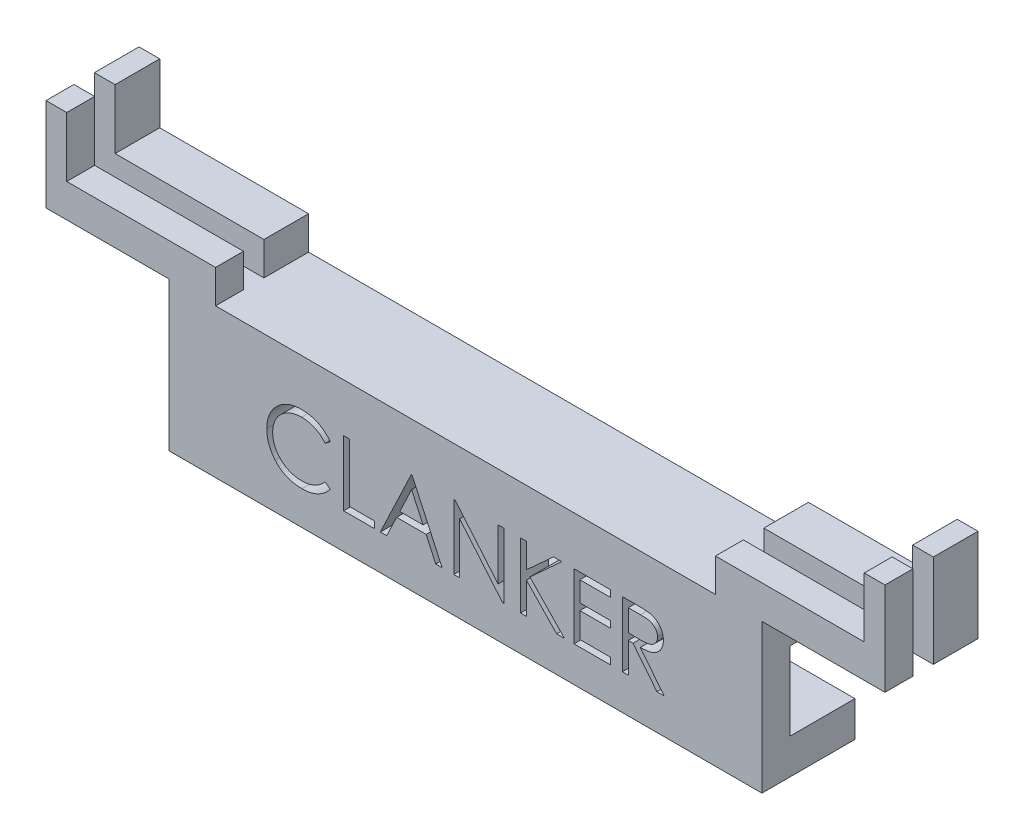
from build123d import *

# Parameters (mm, degrees)
BOSS_EXTRUDE1_DEPTH   = 5
BOSS_EXTRUDE1_2_DEPTH = 5
SKETCH4_W             = 31.87087044
SKETCH4_H             = 8
BOSS_EXTRUDE2_DEPTH   = 5
SKETCH5_W             = 32.67615924
SKETCH5_H             = 4.2
CUT_EXTRUDE1_DEPTH    = 3.5
SKETCH6_W             = 45.1
SKETCH6_H             = 1.1
CUT_EXTRUDE2_DEPTH    = 5
CUT_EXTRUDE3_DEPTH    = 3


with BuildPart() as part:
    # Sketch2 → Boss-Extrude1 (new body)
    with BuildSketch(Plane.XY):
        Polygon((21.435301444, 2.5), (21.435301444, -0.71006712), (13.43543522, -0.71006712), (13.43543522, -2.5), (22.55, -2.5), (22.55, 2.5), align=None)
    extrude(amount=-BOSS_EXTRUDE1_DEPTH)



with BuildPart() as body_2:
    # Sketch2 → Boss-Extrude1 2 (new body)
    with BuildSketch(Plane.XY):
        Polygon((-22.55, 2.5), (-21.435301444, 2.5), (-21.435301444, -0.71006712), (-13.43543522, -0.71006712), (-13.43543522, -2.5), (-22.55, -2.5), align=None)
    extrude(amount=-BOSS_EXTRUDE1_2_DEPTH)


with BuildPart() as part_1:
    add(part.part)

    add(body_2.part)  # Boss-Extrude2 merges body 2
    # Sketch4 → Boss-Extrude2 (add)
    with BuildSketch(Plane.XY):
        with Locations((0, -6.5)):
            Rectangle(SKETCH4_W, SKETCH4_H)
    extrude(amount=-BOSS_EXTRUDE2_DEPTH)

    # Sketch5 → Cut-Extrude1 (cut)
    with BuildSketch(Plane(origin=(0, 0, -5), x_dir=(-1, 0, 0), z_dir=(0, 0, -1))):
        with Locations((0, -6.5)):
            Rectangle(SKETCH5_W, SKETCH5_H)
    extrude(amount=-CUT_EXTRUDE1_DEPTH, mode=Mode.SUBTRACT)

    # Sketch6 → Cut-Extrude2 (cut)
    with BuildSketch(Plane(origin=(0, 2.5, 0), x_dir=(1, 0, 0), z_dir=(0, 1, 0))):
        with Locations((0, 2.05)):
            Rectangle(SKETCH6_W, SKETCH6_H)
    extrude(amount=-CUT_EXTRUDE2_DEPTH, mode=Mode.SUBTRACT)

    # Sketch7 → Cut-Extrude3 (cut)
    # profile 1 of 7: a face of its own
    with BuildSketch(Plane.XY):
        with BuildLine():
            Line((-7.269230769, -5.742227564), (-7.544070513, -5.952564103))
            add(Edge.make_bspline(
                [(-7.544070513, -5.952564103), (-7.563676401, -5.929198133), (-7.602623848, -5.882781217), (-7.665283051, -5.817601673), (-7.730584693, -5.756536411), (-7.798503815, -5.699294531), (-7.870262934, -5.647877766), (-7.944123733, -5.599606663), (-8.021321778, -5.556338925), (-8.128073513, -5.503875939), (-8.267721361, -5.449129784), (-8.4435162, -5.403226552), (-8.627027298, -5.374005377), (-8.752224898, -5.370840535), (-8.815905449, -5.369230769)],
                knots=[0, 0, 0, 0, 0.757959112, 1.505699292, 2.245454638, 2.979532153, 3.711538275, 4.438200793, 5.171680507, 5.909471876, 7.393775596, 8.890124382, 10.418191784, 12, 12, 12, 12], degree=3))
            add(Edge.make_bspline(
                [(-8.815905449, -5.369230769), (-8.850988748, -5.369634732), (-8.920829741, -5.370438908), (-9.024478214, -5.381048033), (-9.126191265, -5.395959243), (-9.225902731, -5.418084566), (-9.32348569, -5.446057185), (-9.419578092, -5.479482599), (-9.512788692, -5.520837439), (-9.60440693, -5.566545699), (-9.692186141, -5.618173144), (-9.775241189, -5.674486496), (-9.853269157, -5.734855592), (-9.926331769, -5.799506698), (-9.994503717, -5.868148659), (-10.057291028, -5.941513), (-10.114476438, -6.019365174), (-10.167193463, -6.100678581), (-10.214406197, -6.185216373), (-10.253936076, -6.273291444), (-10.288941198, -6.363395547), (-10.316640441, -6.456546707), (-10.338564958, -6.552089473), (-10.353692621, -6.650280261), (-10.364181092, -6.750913941), (-10.364981269, -6.819123253), (-10.365384615, -6.853505609)],
                knots=[0, 0, 0, 0, 1.054917814, 2.100044995, 3.131103042, 4.146048494, 5.169673617, 6.183595914, 7.203665975, 8.234915748, 9.262203917, 10.264457458, 11.251630812, 12.227803204, 13.197192746, 14.159520551, 15.12972552, 16.100847026, 17.073214652, 18.039054194, 19.002613845, 19.979014051, 20.95965708, 21.949030935, 22.966165397, 24, 24, 24, 24], degree=3))
            add(Edge.make_bspline(
                [(-10.365384615, -6.853505609), (-10.364122796, -6.905236929), (-10.361645382, -7.006804514), (-10.339597048, -7.155575124), (-10.306091957, -7.298095798), (-10.25587638, -7.43347564), (-10.193957329, -7.563383998), (-10.115716718, -7.685622852), (-10.02510018, -7.802039416), (-9.920825761, -7.909882364), (-9.806419945, -8.008396089), (-9.683672033, -8.095146671), (-9.552887746, -8.167461553), (-9.415511115, -8.2276375), (-9.270485001, -8.273894228), (-9.118070199, -8.306458351), (-8.958598204, -8.327700532), (-8.849628804, -8.32973422), (-8.794170673, -8.330769231)],
                knots=[0, 0, 0, 0, 1.029171465, 2.020641659, 2.987623507, 3.938342917, 4.889210282, 5.84687017, 6.821220943, 7.821438502, 8.827599549, 9.822697543, 10.807740252, 11.797342354, 12.80366471, 13.83203677, 14.896651826, 16, 16, 16, 16], degree=3))
            add(Edge.make_bspline(
                [(-8.794170673, -8.330769231), (-8.733067984, -8.329080451), (-8.612803275, -8.325756528), (-8.436435249, -8.297597279), (-8.267599483, -8.251939362), (-8.106286897, -8.188041439), (-7.95295225, -8.104976151), (-7.80735559, -8.004278274), (-7.66937402, -7.884989941), (-7.586402737, -7.793906813), (-7.544070513, -7.747435897)],
                knots=[0, 0, 0, 0, 1.028121516, 2.023589091, 2.998037872, 3.967518031, 4.937445131, 5.927275754, 6.942489185, 8, 8, 8, 8], degree=3))
            Line((-7.544070513, -7.747435897), (-7.269230769, -7.955669071))
            add(Edge.make_bspline(
                [(-7.269230769, -7.955669071), (-7.291348879, -7.984207522), (-7.335479154, -8.041147729), (-7.406937171, -8.121419438), (-7.482214469, -8.196923474), (-7.561870179, -8.267051095), (-7.64498797, -8.333205561), (-7.733060283, -8.393507392), (-7.824929315, -8.448798276), (-7.920283794, -8.499425201), (-8.019022407, -8.544342448), (-8.121026842, -8.582796216), (-8.225857417, -8.615921105), (-8.333518926, -8.643173042), (-8.444234683, -8.664444126), (-8.557605157, -8.678663801), (-8.673875032, -8.688405715), (-8.752316453, -8.689293631), (-8.792067308, -8.68974359)],
                knots=[0, 0, 0, 0, 0.986787822, 1.968848986, 2.935600012, 3.899624008, 4.868462664, 5.837806735, 6.815139263, 7.798259679, 8.787526145, 9.778297419, 10.776456485, 11.791383307, 12.812564526, 13.85620153, 14.913611965, 16, 16, 16, 16], degree=3))
            add(Edge.make_bspline(
                [(-8.792067308, -8.68974359), (-8.829710975, -8.689481597), (-8.904146665, -8.688963539), (-9.014045416, -8.680571372), (-9.121034997, -8.669121635), (-9.224809623, -8.651881504), (-9.325935598, -8.631537164), (-9.423496183, -8.604265907), (-9.518451393, -8.573716741), (-9.610419734, -8.537811754), (-9.699479434, -8.497295571), (-9.785343245, -8.451504013), (-9.867971677, -8.400822148), (-9.948177098, -8.346367137), (-10.024774682, -8.286389836), (-10.098428207, -8.221723201), (-10.169550683, -8.15258519), (-10.213553368, -8.102730337), (-10.235677083, -8.077664263)],
                knots=[0, 0, 0, 0, 1.114604814, 2.203992996, 3.262667896, 4.300477797, 5.318619304, 6.316056647, 7.298880507, 8.271930387, 9.238335007, 10.195173496, 11.151986948, 12.108099108, 13.064862484, 14.031167946, 15.010108607, 16, 16, 16, 16], degree=3))
            add(Edge.make_bspline(
                [(-10.235677083, -8.077664263), (-10.271112727, -8.034123074), (-10.341556204, -7.947566363), (-10.431681887, -7.807280382), (-10.508829442, -7.660812173), (-10.571205363, -7.507392245), (-10.619968096, -7.347364857), (-10.653749291, -7.180649343), (-10.675700896, -7.007401401), (-10.678211185, -6.889564612), (-10.679487179, -6.829667468)],
                knots=[0, 0, 0, 0, 0.994628077, 1.977248131, 2.950237994, 3.925870899, 4.908910175, 5.911660606, 6.938484602, 8, 8, 8, 8], degree=3))
            add(Edge.make_bspline(
                [(-10.679487179, -6.829667468), (-10.677931986, -6.766712014), (-10.67487224, -6.64285109), (-10.648876444, -6.461077137), (-10.607057648, -6.286925738), (-10.547660759, -6.120721993), (-10.472355408, -5.961591713), (-10.379328794, -5.810750508), (-10.269661652, -5.667233708), (-10.144214084, -5.533218957), (-10.006646749, -5.410679604), (-9.859327935, -5.302873401), (-9.702545988, -5.213155885), (-9.538028137, -5.138159722), (-9.364542455, -5.080515259), (-9.182459086, -5.040162072), (-8.992120171, -5.015044956), (-8.862257745, -5.011869748), (-8.796274038, -5.01025641)],
                knots=[0, 0, 0, 0, 1.032925535, 2.032216505, 3.007276963, 3.968222605, 4.92396291, 5.891752235, 6.871517503, 7.883894988, 8.900124299, 9.891468569, 10.874487609, 11.85992873, 12.854644235, 13.869047385, 14.917252991, 16, 16, 16, 16], degree=3))
            add(Edge.make_bspline(
                [(-8.796274038, -5.01025641), (-8.756059567, -5.010738548), (-8.676459069, -5.011692892), (-8.558706417, -5.020999035), (-8.44406409, -5.036512641), (-8.332453108, -5.057628711), (-8.223330492, -5.083836032), (-8.117530251, -5.11797633), (-8.014431564, -5.157012862), (-7.914684656, -5.201971328), (-7.818768106, -5.252438069), (-7.726711787, -5.307853693), (-7.639246928, -5.368149498), (-7.55575808, -5.432812674), (-7.477641869, -5.503211233), (-7.40268039, -5.577408829), (-7.333419312, -5.657542653), (-7.290666117, -5.713947587), (-7.269230769, -5.742227564)],
                knots=[0, 0, 0, 0, 1.096760587, 2.17092713, 3.219439832, 4.250915756, 5.268269357, 6.278326846, 7.281116186, 8.274029601, 9.260640565, 10.235837813, 11.203064059, 12.156899882, 13.114053108, 14.069676657, 15.032185724, 16, 16, 16, 16], degree=3))
        make_face()
    # profile 2 of 7: a face of its own
    with BuildSketch(Plane.XY):
        Polygon((-6.551282051, -5.1), (-6.237179487, -5.1), (-6.237179487, -8.241025641), (-4.891025641, -8.241025641), (-4.891025641, -8.6), (-6.551282051, -8.6), align=None)
    # profile 3 of 7: a face of its own
    with BuildSketch(Plane.XY):
        Polygon((-2.871794872, -5.1), (-1.256410256, -8.6), (-1.597856571, -8.6), (-2.115284455, -7.478205128), (-3.701923077, -7.478205128), (-4.234074519, -8.6), (-4.576923077, -8.6), (-2.916666667, -5.1), align=None)
        Polygon((-2.897736378, -5.782191506), (-3.531550481, -7.119230769), (-2.280749199, -7.119230769), align=None, mode=Mode.SUBTRACT)
    # profile 4 of 7: a face of its own
    with BuildSketch(Plane.XY):
        Polygon((-0.628205128, -8.6), (-0.628205128, -5.1), (-0.562299679, -5.1), (1.75, -7.854707532), (1.75, -5.1), (2.064102564, -5.1), (2.064102564, -8.6), (1.992588141, -8.6), (-0.314102564, -5.851602564), (-0.314102564, -8.6), align=None)
    # profile 5 of 7: a face of its own
    with BuildSketch(Plane.XY):
        Polygon((2.961538462, -5.1), (3.275641026, -5.1), (3.275641026, -6.432832532), (4.734675481, -5.1), (5.182692308, -5.1), (3.462840545, -6.670512821), (5.317307692, -8.6), (4.898737981, -8.6), (3.275641026, -6.910997596), (3.275641026, -8.6), (2.961538462, -8.6), align=None)
    # profile 6 of 7: a face of its own
    with BuildSketch(Plane.XY):
        Polygon((5.833333333, -5.1), (7.807692308, -5.1), (7.807692308, -5.458974359), (6.147435897, -5.458974359), (6.147435897, -6.535897436), (7.807692308, -6.535897436), (7.807692308, -6.894871795), (6.147435897, -6.894871795), (6.147435897, -8.241025641), (7.807692308, -8.241025641), (7.807692308, -8.6), (5.833333333, -8.6), align=None)
    # profile 7 of 7: a face of its own
    with BuildSketch(Plane.XY):
        with BuildLine():
            Line((8.435897436, -5.1), (9.136318109, -5.1))
            add(Edge.make_bspline(
                [(9.136318109, -5.1), (9.183059237, -5.100155586), (9.272807382, -5.100454328), (9.401380652, -5.102120091), (9.518207749, -5.106894447), (9.623227589, -5.11100303), (9.716438244, -5.118494972), (9.798125534, -5.125655619), (9.867913232, -5.13502928), (9.910159083, -5.143734703), (9.929286859, -5.147676282)],
                knots=[0, 0, 0, 0, 1.410062039, 2.707475311, 3.878576406, 4.937260626, 5.877586885, 6.699081471, 7.410979367, 8, 8, 8, 8], degree=3))
            add(Edge.make_bspline(
                [(9.929286859, -5.147676282), (9.954893483, -5.154003047), (10.005560473, -5.166521611), (10.078510539, -5.192981212), (10.148024863, -5.223600837), (10.213814687, -5.259564557), (10.275550478, -5.301139337), (10.333868789, -5.347607459), (10.389034252, -5.398714665), (10.438815882, -5.455749506), (10.485754934, -5.515586016), (10.525343561, -5.580289773), (10.55947004, -5.6479513), (10.586640557, -5.719258718), (10.608518531, -5.79352049), (10.62394477, -5.871409287), (10.633195958, -5.952570262), (10.634137813, -6.00792817), (10.634615385, -6.035997596)],
                knots=[0, 0, 0, 0, 1.027469482, 2.033020251, 3.019912614, 3.986113645, 4.951240523, 5.91722682, 6.890402269, 7.87763091, 8.8651537, 9.85103654, 10.82876324, 11.815024772, 12.821070561, 13.842952187, 14.906261191, 16, 16, 16, 16], degree=3))
            add(Edge.make_bspline(
                [(10.634615385, -6.035997596), (10.633146387, -6.082632701), (10.630279991, -6.173629869), (10.603554887, -6.30569075), (10.559778367, -6.428880065), (10.499455078, -6.543042703), (10.422635603, -6.645953348), (10.330310811, -6.736343803), (10.2224292, -6.811983716), (10.121999884, -6.864436521), (10.033285684, -6.898029429), (9.960252372, -6.921665788), (9.880585394, -6.939927753), (9.795048059, -6.956287885), (9.703284404, -6.96863958), (9.605514365, -6.977686174), (9.501668213, -6.983340223), (9.430329144, -6.984182228), (9.393629808, -6.984615385)],
                knots=[0, 0, 0, 0, 1.260483769, 2.459530307, 3.627416485, 4.787058657, 5.939039949, 7.08810263, 8.267026773, 9.491475466, 10.141966685, 10.831826277, 11.566392101, 12.351337768, 13.187381173, 14.07005841, 15.007169909, 16, 16, 16, 16], degree=3))
            Line((9.393629808, -6.984615385), (10.679487179, -8.6))
            Line((10.679487179, -8.6), (10.291065705, -8.6))
            Line((10.291065705, -8.6), (9.005208333, -6.984615385))
            Line((9.005208333, -6.984615385), (8.75, -6.984615385))
            Line((8.75, -6.984615385), (8.75, -8.6))
            Line((8.75, -8.6), (8.435897436, -8.6))
            Line((8.435897436, -8.6), (8.435897436, -5.1))
        make_face()
        with BuildLine():
            Line((8.75, -5.458974359), (8.75, -6.625641026))
            Line((8.75, -6.625641026), (9.390825321, -6.630548878))
            add(Edge.make_bspline(
                [(9.390825321, -6.630548878), (9.420745359, -6.630562115), (9.478738917, -6.630587771), (9.562639581, -6.626593995), (9.640759693, -6.622050677), (9.712800445, -6.615101331), (9.778794021, -6.60614526), (9.838707434, -6.594942275), (9.892638486, -6.581890213), (9.955537024, -6.561688587), (10.025773555, -6.529682569), (10.102105015, -6.48311707), (10.167107353, -6.424547951), (10.222025215, -6.357574495), (10.266154647, -6.283938246), (10.297266701, -6.204521877), (10.317009143, -6.121330279), (10.319337689, -6.064152171), (10.320512821, -6.035296474)],
                knots=[0, 0, 0, 0, 1.146690395, 2.22261258, 3.21895312, 4.145990853, 4.996080663, 5.770904154, 6.481378293, 7.121626537, 8.300444488, 9.431385265, 10.535395872, 11.636531494, 12.74115979, 13.810798291, 14.895190096, 16, 16, 16, 16], degree=3))
            add(Edge.make_bspline(
                [(10.320512821, -6.035296474), (10.319310699, -6.007149901), (10.316928534, -5.951373662), (10.297479766, -5.869717752), (10.264590384, -5.792650802), (10.220268146, -5.720486317), (10.166268991, -5.654980581), (10.102951179, -5.598933428), (10.032045983, -5.552683963), (9.965774785, -5.523129582), (9.906540573, -5.505009729), (9.855110913, -5.492258565), (9.796999435, -5.482014096), (9.731923976, -5.473806036), (9.660162345, -5.466751091), (9.581351694, -5.461999313), (9.496014914, -5.459185449), (9.436867983, -5.45904636), (9.40625, -5.458974359)],
                knots=[0, 0, 0, 0, 1.101028733, 2.181837193, 3.264309656, 4.369019818, 5.486613113, 6.575447106, 7.666700264, 8.788928104, 9.402425223, 10.0903467, 10.862060571, 11.710948788, 12.657782767, 13.684531032, 14.801375019, 16, 16, 16, 16], degree=3))
            Line((9.40625, -5.458974359), (8.75, -5.458974359))
        make_face(mode=Mode.SUBTRACT)
    extrude(amount=-CUT_EXTRUDE3_DEPTH, mode=Mode.SUBTRACT)


with BuildPart() as cut_extrude3_piece_1:
    # of the separate pieces the step leaves, piece 1, a body of its own (cut_extrude3_pieces)
    add(part_1.part.solids().sort_by_distance((21.435301444, 2.5, 0))[0])


with BuildPart() as cut_extrude3_piece_2:
    # of the separate pieces the step leaves, piece 2, a body of its own (cut_extrude3_pieces)
    add(part_1.part.solids().sort_by_distance((9.40625, -5.458974359, 0))[0])


with BuildPart() as cut_extrude3_piece_3:
    # of the separate pieces the step leaves, piece 3, a body of its own (cut_extrude3_pieces)
    add(part_1.part.solids().sort_by_distance((-2.280749199, -7.119230769, 0))[0])


solid = Compound([cut_extrude3_piece_1.part, cut_extrude3_piece_2.part, cut_extrude3_piece_3.part])
